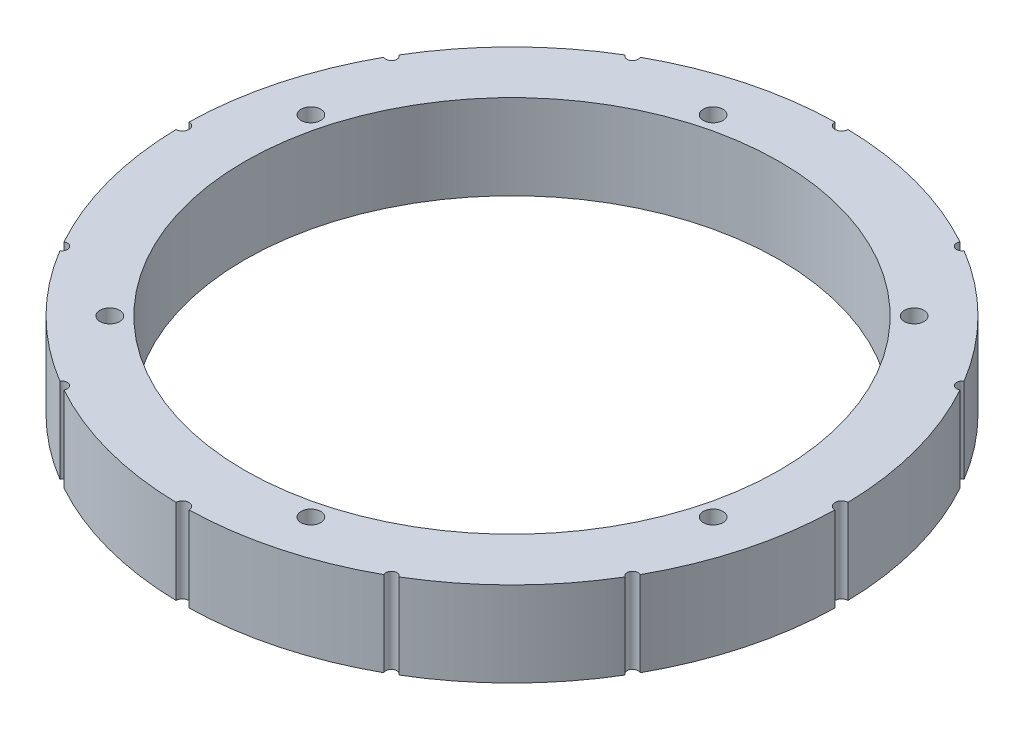
from build123d import *

# Parameters (mm, degrees)
SKETCH_1_R               = 50.4
SKETCH_1_R_2             = 40.9
EXTRUDE_1_DEPTH          = 13
SKETCH_2_R               = 1
SKETCH_2_R_2             = 0.85
CUT_EXTRUDE_1_DEPTH      = 13
SKETCH_3_R               = 1.5
CUT_EXTRUDE_2_DEPTH      = 5
PATTERN_CIRCULAR_1_COUNT = 6


with BuildPart() as part:
    # 草图1 → 凸台-拉伸1 (new body)
    with BuildSketch(Plane(origin=(0, 0, 0), x_dir=(1, 0, 0), z_dir=(0, 1, 0))):
        with Locations(Location((0, 0, 0), (0, 0, 270))):
            Circle(SKETCH_1_R)
        with Locations(Location((0, 0, 0), (0, 0, 270))):
            Circle(SKETCH_1_R_2, mode=Mode.SUBTRACT)
    extrude(amount=-EXTRUDE_1_DEPTH)

    # 草图2 → 切除-拉伸1 (cut)
    with BuildSketch(Plane.XZ.offset(13)):
        with Locations((0, 50.4)):
            Circle(SKETCH_2_R)
        with Locations((50.4, 0)):
            Circle(SKETCH_2_R)
        with Locations((0, -50.4)):
            Circle(SKETCH_2_R)
        with Locations((-50.4, 0)):
            Circle(SKETCH_2_R)
        with Locations((-25.2, 43.647680351)):
            Circle(SKETCH_2_R_2)
        with Locations((25.2, 43.647680351)):
            Circle(SKETCH_2_R_2)
        with Locations((43.647680351, 25.2)):
            Circle(SKETCH_2_R_2)
        with Locations((43.647680351, -25.2)):
            Circle(SKETCH_2_R_2)
        with Locations((25.2, -43.647680351)):
            Circle(SKETCH_2_R_2)
        with Locations((-25.2, -43.647680351)):
            Circle(SKETCH_2_R_2)
        with Locations((-43.647680351, -25.2)):
            Circle(SKETCH_2_R_2)
        with Locations((-43.647680351, 25.2)):
            Circle(SKETCH_2_R_2)
    extrude(amount=-CUT_EXTRUDE_1_DEPTH, mode=Mode.SUBTRACT)

    # 草图3 → 切除-拉伸2 (cut)
    with BuildSketch(Plane(origin=(0, 0, 0), x_dir=(1, 0, 0), z_dir=(0, 1, 0))):
        with Locations(Location((-11.258628462, 42.017773444, 0), (0, 0, 270))):
            Circle(SKETCH_3_R)
    cut_extrude_2 = extrude(amount=-CUT_EXTRUDE_2_DEPTH, mode=Mode.SUBTRACT)

    # 阵列(圆周)1: 切除-拉伸2 ×6 about axis
    pattern_circular_1_axis = Axis((0, 0, 0), (0, 1, 0))
    for i in range(1, PATTERN_CIRCULAR_1_COUNT):
        add(cut_extrude_2.rotate(pattern_circular_1_axis, i * 360 / PATTERN_CIRCULAR_1_COUNT), mode=Mode.SUBTRACT)


solid = part.part
